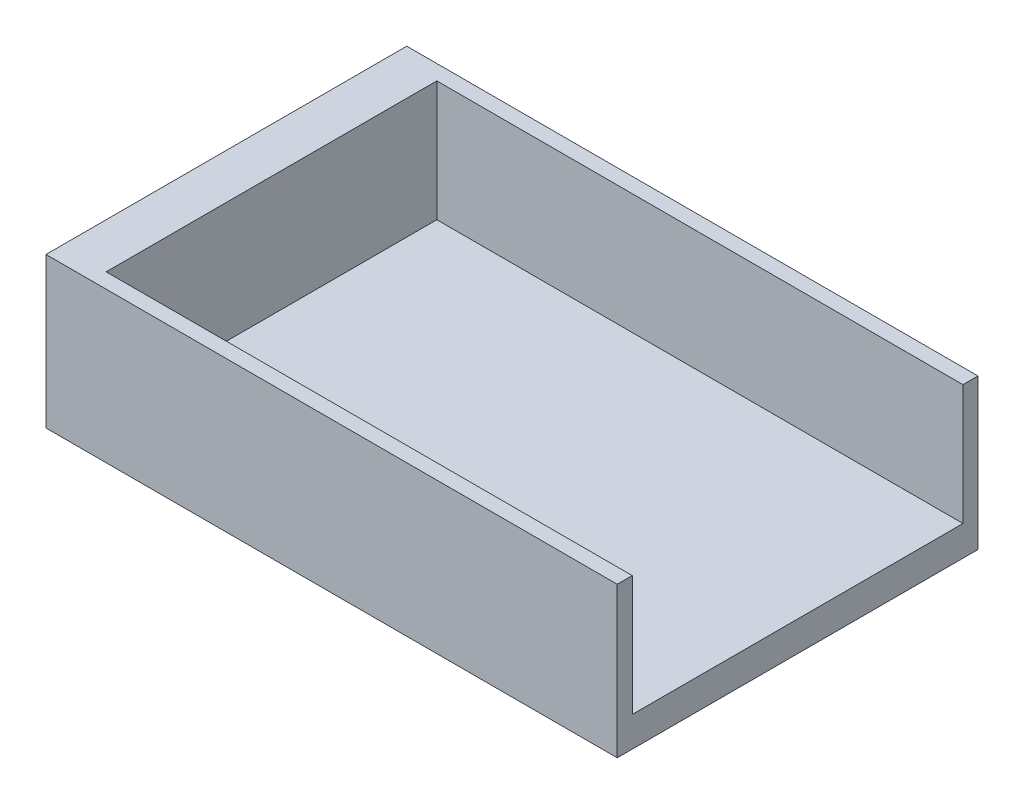
from build123d import *

# Parameters (mm, degrees)
SKETCH1_W           = 40
SKETCH1_H           = 24
BOSS_EXTRUDE1_DEPTH = 2
SKETCH2_W           = 40
SKETCH2_H           = 24
SKETCH2_W_2         = 36
SKETCH2_H_2         = 22
BOSS_EXTRUDE3_DEPTH = 8
SKETCH5_W           = 4
SKETCH5_H           = 3
CUT_EXTRUDE1_DEPTH  = 2
SKETCH6_W           = 24
SKETCH6_H           = 10
CUT_EXTRUDE2_DEPTH  = 2


with BuildPart() as part:
    # Sketch1 → Boss-Extrude1 (new body)
    with BuildSketch(Plane(origin=(0, 0, 0), x_dir=(1, 0, 0), z_dir=(0, 1, 0))):
        with Locations((20, 12)):
            Rectangle(SKETCH1_W, SKETCH1_H)
    extrude(amount=BOSS_EXTRUDE1_DEPTH)

    # Sketch2 → Boss-Extrude3 (add)
    with BuildSketch(Plane(origin=(0, 2, 0), x_dir=(1, 0, 0), z_dir=(0, 1, 0))):
        with Locations((20, 12)):
            Rectangle(SKETCH2_W, SKETCH2_H)
        with Locations((21, 12)):
            Rectangle(SKETCH2_W_2, SKETCH2_H_2, mode=Mode.SUBTRACT)
    extrude(amount=BOSS_EXTRUDE3_DEPTH)

    # Sketch5 → Cut-Extrude1 (cut)
    with BuildSketch(Plane(origin=(0, 2, 0), x_dir=(1, 0, 0), z_dir=(0, 1, 0))):
        with Locations((6, 2.5)):
            Rectangle(SKETCH5_W, SKETCH5_H)
    extrude(amount=-CUT_EXTRUDE1_DEPTH, mode=Mode.SUBTRACT)

    # Sketch6 → Cut-Extrude2 (cut)
    with BuildSketch(Plane(origin=(40, 0, 0), x_dir=(0, 0, -1), z_dir=(1, 0, 0))):
        with Locations((12, 5)):
            Rectangle(SKETCH6_W, SKETCH6_H)
    extrude(amount=-CUT_EXTRUDE2_DEPTH, mode=Mode.SUBTRACT)


solid = part.part
